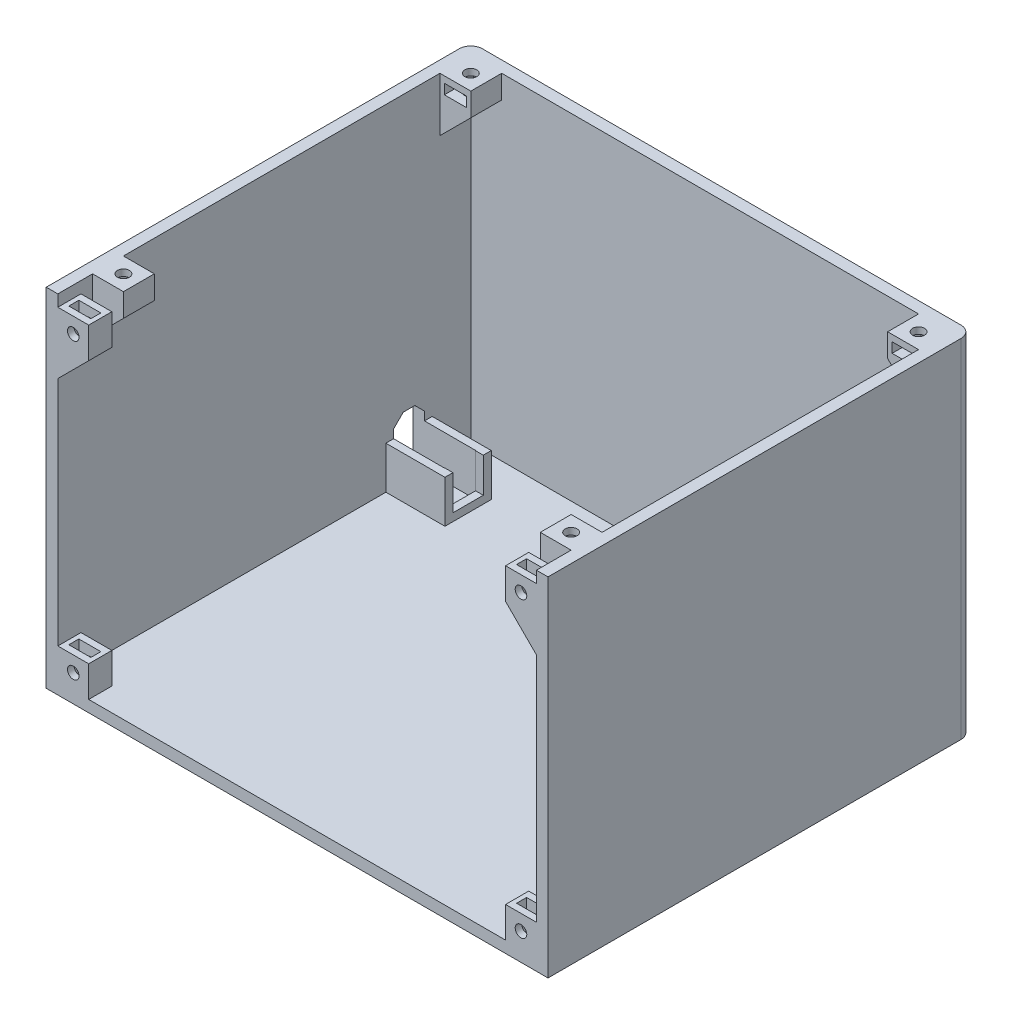
from build123d import *

# Parameters (mm, degrees)
SKETCH_2_W                  = 130
SKETCH_2_H                  = 90
EXTRUDE_1_DEPTH             = 110
SKETCH_3_W                  = 124
SKETCH_3_H                  = 107
CUT_EXTRUDE_1_DEPTH         = 87
CUT_EXTRUDE_5_REACH         = 178.139
EXTRUDE_5_DEPTH             = 11
SKETCH_16_W                 = 5.817441426
SKETCH_16_H                 = 7.857396668
CUT_EXTRUDE_6_DEPTH         = 9
FILLET_8_R                  = 3
FILLET_9_R                  = 3
SKETCH_17_W                 = 8
SKETCH_17_H                 = 8
SKETCH_17_R                 = 1.5
EXTRUDE_6_DEPTH             = 6
PATTERN_LINEAR_1_COUNT      = 2
PATTERN_LINEAR_1_PITCH      = 116
PATTERN_LINEAR_1_COUNT_DIR2 = 2
PATTERN_LINEAR_1_PITCH_DIR2 = 76
EXTRUDE_7_DEPTH             = 6
EXTRUDE_8_DEPTH             = 6
SKETCH_20_W                 = 5.7
SKETCH_20_H                 = 2.6
CUT_EXTRUDE_7_DEPTH         = 7.5
PATTERN_LINEAR_2_COUNT      = 2
PATTERN_LINEAR_2_PITCH      = 116
PATTERN_LINEAR_2_COUNT_DIR2 = 2
PATTERN_LINEAR_2_PITCH_DIR2 = 76
SKETCH_23_W                 = 8
SKETCH_23_H                 = 8
SKETCH_23_R                 = 1.55
EXTRUDE_9_DEPTH             = 6
PATTERN_LINEAR_3_COUNT      = 2
PATTERN_LINEAR_3_PITCH      = 116
PATTERN_LINEAR_3_COUNT_DIR2 = 2
PATTERN_LINEAR_3_PITCH_DIR2 = 90
EXTRUDE_10_DEPTH            = 8
EXTRUDE_11_DEPTH            = 8
PATTERN_LINEAR_4_COUNT      = 2
PATTERN_LINEAR_4_PITCH      = 90
PATTERN_LINEAR_5_COUNT      = 2
PATTERN_LINEAR_5_PITCH      = 90
SKETCH_27_W                 = 5.7
SKETCH_27_H                 = 2.6
CUT_EXTRUDE_8_DEPTH         = 7.5
PATTERN_LINEAR_6_COUNT      = 2
PATTERN_LINEAR_6_PITCH      = 116
SKETCH_28_W                 = 5.7
SKETCH_28_H                 = 2.6
CUT_EXTRUDE_9_DEPTH         = 7.5
PATTERN_LINEAR_7_COUNT      = 2
PATTERN_LINEAR_7_PITCH      = 116


with BuildPart() as part:
    # Эскиз2 → Бобышка-Вытянуть1 (new body)
    with BuildSketch(Plane.XY):
        Rectangle(SKETCH_2_W, SKETCH_2_H)
    extrude(amount=EXTRUDE_1_DEPTH)

    # Эскиз3 → Вырез-Вытянуть1 (cut)
    with BuildSketch(Plane(origin=(0, 45, 0), x_dir=(1, 0, 0), z_dir=(0, 1, 0))):
        with Locations((0, -56.5)):
            Rectangle(SKETCH_3_W, SKETCH_3_H)
    extrude(amount=-CUT_EXTRUDE_1_DEPTH, mode=Mode.SUBTRACT)

    # Эскиз13 → Вырез-Вытянуть5 (cut, up to next)
    with BuildSketch(Plane.ZY.offset(65), mode=Mode.PRIVATE) as cut_extrude_5_sk1:
        Polygon((15, -42), (23, -42), (23, -28.8), (20.505788704, -26.3), (17.494211296, -26.3), (15, -28.8), align=None)
    cut_extrude_5_tool1 = extrude(cut_extrude_5_sk1.sketch, amount=-CUT_EXTRUDE_5_REACH, mode=Mode.PRIVATE) & part.part
    add(cut_extrude_5_tool1.solids().sort_by_distance((-65, -34.516546, 19))[0], mode=Mode.SUBTRACT)

    # Эскиз15 → Бобышка-Вытянуть5 (add)
    with BuildSketch(Plane(origin=(0, -42, 0), x_dir=(1, 0, 0), z_dir=(0, 1, 0))):
        Polygon((-62, -25), (-46.7, -25), (-46.7, -13), (-62, -13), (-62, -15), (-48.7, -15), (-48.7, -23), (-62, -23), align=None)
    extrude(amount=EXTRUDE_5_DEPTH)

    # Эскиз16 → Вырез-Вытянуть6 (cut)
    with BuildSketch(Plane(origin=(0, -31, 0), x_dir=(1, 0, 0), z_dir=(0, 1, 0))):
        with Locations((-46.7, -19)):
            Rectangle(SKETCH_16_W, SKETCH_16_H)
    extrude(amount=-CUT_EXTRUDE_6_DEPTH, mode=Mode.SUBTRACT)

    # Скругление8
    fillet_8_edges = [part.edges().sort_by_distance(p)[0] for p in [
        (-65, 0, 0),
    ]]
    fillet(fillet_8_edges, radius=FILLET_8_R)

    # Скругление9
    fillet_9_edges = [part.edges().sort_by_distance(p)[0] for p in [
        (65, 0, 0),
    ]]
    fillet(fillet_9_edges, radius=FILLET_9_R)

    # Эскиз17 → Бобышка-Вытянуть6 (add)
    with BuildSketch(Plane.XY.offset(110)):
        with Locations((-58, -38)):
            Rectangle(SKETCH_17_W, SKETCH_17_H)
        with Locations((-58, -38)):
            Circle(SKETCH_17_R, mode=Mode.SUBTRACT)
    extrude_6 = extrude(amount=-EXTRUDE_6_DEPTH)

    # Линейный массив1: Extrude 6 2 × 2
    with Locations(*[(i * PATTERN_LINEAR_1_PITCH, j * PATTERN_LINEAR_1_PITCH_DIR2, 0) for i in range(PATTERN_LINEAR_1_COUNT) for j in range(PATTERN_LINEAR_1_COUNT_DIR2) if (i, j) != (0, 0)]):
        add(extrude_6)

    # Эскиз18 → Бобышка-Вытянуть7 (add)
    with BuildSketch(Plane.XY.offset(110)):
        Polygon((-54, 34), (-62, 34), (-62, 26), align=None)
    extrude(amount=-EXTRUDE_7_DEPTH)

    # Эскиз19 → Бобышка-Вытянуть8 (add)
    with BuildSketch(Plane.XY.offset(110)):
        Polygon((62, 34), (54, 34), (62, 26), align=None)
    extrude(amount=-EXTRUDE_8_DEPTH)

    # Эскиз20 → Вырез-Вытянуть7 (cut)
    with BuildSketch(Plane(origin=(0, -34, 0), x_dir=(1, 0, 0), z_dir=(0, 1, 0))):
        with Locations((-58, -107)):
            Rectangle(SKETCH_20_W, SKETCH_20_H)
    cut_extrude_7 = extrude(amount=-CUT_EXTRUDE_7_DEPTH, mode=Mode.SUBTRACT)

    # Линейный массив2: Cut-Extrude 7 2 × 2
    with Locations(*[(i * PATTERN_LINEAR_2_PITCH, j * PATTERN_LINEAR_2_PITCH_DIR2, 0) for i in range(PATTERN_LINEAR_2_COUNT) for j in range(PATTERN_LINEAR_2_COUNT_DIR2) if (i, j) != (0, 0)]):
        add(cut_extrude_7, mode=Mode.SUBTRACT)



with BuildPart() as body_2:
    # Эскиз23 → Бобышка-Вытянуть9 (new body)
    with BuildSketch(Plane(origin=(0, 45, 0), x_dir=(1, 0, 0), z_dir=(0, 1, 0))):
        with Locations((-58, -7)):
            Rectangle(SKETCH_23_W, SKETCH_23_H)
        with Locations(Location((-58, -7, 0), (0, 0, 270))):
            Circle(SKETCH_23_R, mode=Mode.SUBTRACT)
    extrude_9 = extrude(amount=-EXTRUDE_9_DEPTH)


with BuildPart() as pattern_linear_3_1:
    # Линейный массив3: pattern copy
    add(extrude_9.moved(Location(Vector(1, 0, 0) * (0 * PATTERN_LINEAR_3_PITCH) + Vector(0, 0, 1) * (1 * PATTERN_LINEAR_3_PITCH_DIR2))))


with BuildPart() as pattern_linear_3_2:
    # Линейный массив3: pattern copy
    add(extrude_9.moved(Location(Vector(1, 0, 0) * (1 * PATTERN_LINEAR_3_PITCH) + Vector(0, 0, 1) * (0 * PATTERN_LINEAR_3_PITCH_DIR2))))


with BuildPart() as pattern_linear_3_3:
    # Линейный массив3: pattern copy
    add(extrude_9.moved(Location(Vector(1, 0, 0) * (1 * PATTERN_LINEAR_3_PITCH) + Vector(0, 0, 1) * (1 * PATTERN_LINEAR_3_PITCH_DIR2))))


with BuildPart() as part_1:
    add(part.part)

    add(body_2.part)  # Бобышка-Вытянуть10 merges body 2
    # Эскиз24 → Бобышка-Вытянуть10 (add)
    with BuildSketch(Plane.XY.offset(3)):
        Polygon((-54, 39), (-62, 39), (-62, 31), align=None)
    extrude_10 = extrude(amount=EXTRUDE_10_DEPTH)


    add(pattern_linear_3_2.part)  # Бобышка-Вытянуть11 merges Линейный массив3_2
    # Эскиз25 → Бобышка-Вытянуть11 (add)
    with BuildSketch(Plane.XY.offset(3)):
        Polygon((54, 39), (62, 39), (62, 31), align=None)
    extrude_11 = extrude(amount=EXTRUDE_11_DEPTH)


    add(pattern_linear_3_1.part)  # Линейный массив4 merges Линейный массив3_1
    # Линейный массив4: Бобышка-Вытянуть10 ×2
    with Locations(*[(0, 0, i * PATTERN_LINEAR_4_PITCH) for i in range(1, PATTERN_LINEAR_4_COUNT)]):
        add(extrude_10)


    add(pattern_linear_3_3.part)  # Линейный массив5 merges Линейный массив3_3
    # Линейный массив5: Бобышка-Вытянуть11 ×2
    with Locations(*[(0, 0, i * PATTERN_LINEAR_5_PITCH) for i in range(1, PATTERN_LINEAR_5_COUNT)]):
        add(extrude_11)

    # Эскиз27 → Вырез-Вытянуть8 (cut)
    with BuildSketch(Plane.XY.offset(11)):
        with Locations((-58, 42.036350265)):
            Rectangle(SKETCH_27_W, SKETCH_27_H)
    cut_extrude_8 = extrude(amount=-CUT_EXTRUDE_8_DEPTH, mode=Mode.SUBTRACT)

    # Линейный массив6: Вырез-Вытянуть8 ×2
    with Locations(*[(i * PATTERN_LINEAR_6_PITCH, 0, 0) for i in range(1, PATTERN_LINEAR_6_COUNT)]):
        add(cut_extrude_8, mode=Mode.SUBTRACT)

    # Эскиз28 → Вырез-Вытянуть9 (cut)
    with BuildSketch(Plane(origin=(0, 0, 93), x_dir=(-1, 0, 0), z_dir=(0, 0, -1))):
        with Locations((-58, 42)):
            Rectangle(SKETCH_28_W, SKETCH_28_H)
    cut_extrude_9 = extrude(amount=-CUT_EXTRUDE_9_DEPTH, mode=Mode.SUBTRACT)

    # Линейный массив7: Вырез-Вытянуть9 ×2
    with Locations(*[(-i * PATTERN_LINEAR_7_PITCH, 0, 0) for i in range(1, PATTERN_LINEAR_7_COUNT)]):
        add(cut_extrude_9, mode=Mode.SUBTRACT)


solid = part_1.part
